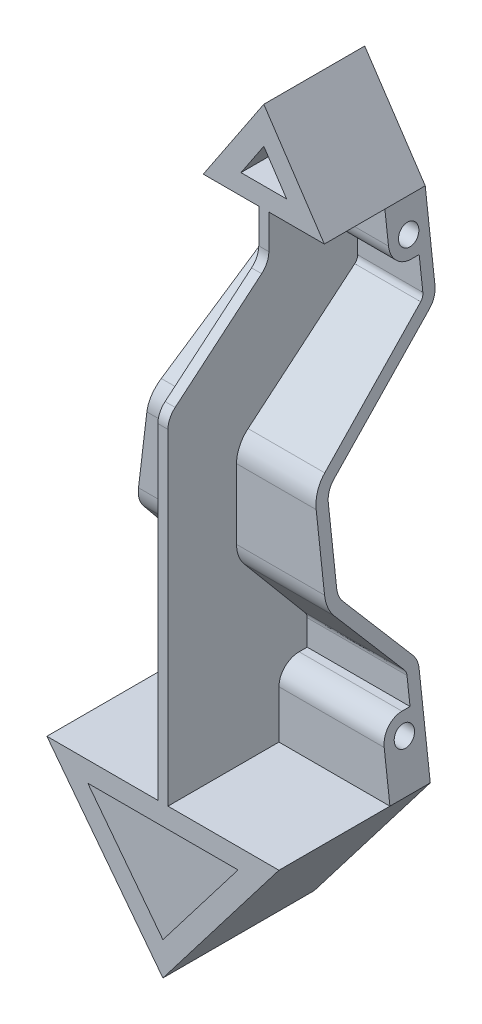
from build123d import *

# Parameters (mm, degrees)
BOSS_EXTRUDE1_DEPTH             = 57.5
CUT_EXTRUDE1_DEPTH              = 334.110342079
CUT_EXTRUDE4_START              = 2.5
CUT_EXTRUDE4_DEPTH              = 322.334448445
BOSS_EXTRUDE2_REACH             = 325.834
SKETCH9_R                       = 5
BOSS_EXTRUDE2_DIRECTION_2_REACH = 325.834
CUT_EXTRUDE5_DEPTH              = 324.834448483
CUT_EXTRUDE5_DEPTH_BACK         = 324.834448483
SKETCH9_3_R                     = 5


with BuildPart() as part:
    # Sketch3 → Boss-Extrude1 (new, symmetric)
    with BuildSketch(Plane.YZ):
        with BuildLine():
            Line((242.818015058, -8.927876097), (206.857769199, 33.927876097))
            ThreePointArc((206.857769199, 33.927876097), (203.423507385, 36.56307787), (199.197324767, 37.5))
            Line((199.197324767, 37.5), (-37.5, 37.5))
            Line((-37.5, 37.5), (-37.5, -37.5))
            Line((-37.5, -37.5), (83.860297657, -37.5))
            ThreePointArc((83.860297657, -37.5), (87.280499091, -36.896926208), (90.288173754, -35.160444431))
            Line((90.288173754, -35.160444431), (126.423201987, -4.839555569))
            ThreePointArc((126.423201987, -4.839555569), (129.43087665, -3.103073792), (132.851078083, -2.5))
            Line((132.851078083, -2.5), (167.490945548, -2.5))
            ThreePointArc((167.490945548, -2.5), (171.717128165, -3.43692213), (175.151389979, -6.072123903))
            Line((175.151389979, -6.072123903), (219.50263215, -58.927876097))
            ThreePointArc((219.50263215, -58.927876097), (222.936893964, -61.56307787), (227.163076582, -62.5))
            Line((227.163076582, -62.5), (312.5, -62.5))
            Line((312.5, -62.5), (312.5, -12.5))
            Line((312.5, -12.5), (250.478459489, -12.5))
            ThreePointArc((250.478459489, -12.5), (246.252276872, -11.56307787), (242.818015058, -8.927876097))
        make_face()
    extrude(amount=BOSS_EXTRUDE1_DEPTH, both=True)

    # Sketch4 → Cut-Extrude1 (cut, through all)
    with BuildSketch(Plane.XY.offset(37.5)):
        Polygon((57.5, 312.5), (0, 312.5), (30, 267.5), (57.5, 37.5), align=None)
        Polygon((-30, 267.5), (0, 312.5), (-57.5, 312.5), (-57.5, 37.5), align=None)
        Polygon((11.314829082, 277.5), (0, 294.472243623), (-11.314829082, 277.5), align=None)
        Polygon((0, -37.5), (-57.5, 37.5), (-57.5, -37.5), align=None)
        Polygon((57.5, -37.5), (57.5, 37.5), (0, -37.5), align=None)
        Polygon((-37.232627886, 27.5), (0, -21.064297242), (37.232627886, 27.5), align=None)
    extrude(amount=-CUT_EXTRUDE1_DEPTH, mode=Mode.SUBTRACT)

    # Sketch7 → Cut-Extrude4 (cut, through all)
    with BuildSketch(Plane.YZ.offset(CUT_EXTRUDE4_START)):
        with BuildLine():
            Line((37.5, 37.5), (37.5, -31.5))
            Line((37.5, -31.5), (83.860297657, -31.5))
            add(Edge.make_bspline(
                [(83.860297657, -31.5), (84.097540548, -31.5), (84.57337446, -31.458390238), (85.263019182, -31.273484118), (85.908338575, -30.972374338), (86.294621244, -30.70182834), (86.474686107, -30.55073598)],
                knots=[-1.570796327, -1.570796327, -1.570796327, -1.570796327, -1.396263402, -1.221730476, -1.047197551, -0.872664626, -0.872664626, -0.872664626, -0.872664626], degree=3))
            Line((86.474686107, -30.55073598), (122.609714339, -0.229847118))
            add(Edge.make_bspline(
                [(122.609714339, -0.229847118), (123.320382845, 0.366474563), (124.848442038, 1.436524541), (127.37869722, 2.615963904), (130.072824203, 3.338033288), (131.926306613, 3.5), (132.851078083, 3.5)],
                knots=[1.570796327, 1.570796327, 1.570796327, 1.570796327, 1.745329252, 1.919862177, 2.094395102, 2.268928028, 2.268928028, 2.268928028, 2.268928028], degree=3))
            Line((132.851078083, 3.5), (167.490945548, 3.5))
            add(Edge.make_bspline(
                [(167.490945548, 3.5), (168.646100732, 3.5), (170.964100646, 3.246604285), (174.273089477, 2.122910497), (177.265048317, 0.308445679), (178.955852245, -1.310444394), (179.701732038, -2.199349317)],
                knots=[0.698131701, 0.698131701, 0.698131701, 0.698131701, 0.916297857, 1.134464014, 1.35263017, 1.570796327, 1.570796327, 1.570796327, 1.570796327], degree=3))
            Line((179.701732038, -2.199349317), (224.052974209, -55.055101511))
            add(Edge.make_bspline(
                [(224.052974209, -55.055101511), (224.24085811, -55.279012825), (224.665398004, -55.685610911), (225.425771497, -56.147439629), (226.271617671, -56.434873066), (226.866794678, -56.5), (227.163076582, -56.5)],
                knots=[-2.443460953, -2.443460953, -2.443460953, -2.443460953, -2.225294796, -2.00712864, -1.788962483, -1.570796327, -1.570796327, -1.570796327, -1.570796327], degree=3))
            Line((227.163076582, -56.5), (267.5, -56.5))
            Line((267.5, -56.5), (267.5, -12.5))
            Line((267.5, -12.5), (250.478459489, -12.5))
            ThreePointArc((250.478459489, -12.5), (246.252276872, -11.56307787), (242.818015058, -8.927876097))
            Line((242.818015058, -8.927876097), (206.857769199, 33.927876097))
            ThreePointArc((206.857769199, 33.927876097), (203.423507385, 36.56307787), (199.197324767, 37.5))
            Line((199.197324767, 37.5), (37.5, 37.5))
        make_face()
    cut_extrude4 = extrude(amount=CUT_EXTRUDE4_DEPTH, mode=Mode.SUBTRACT)

    # Mirror1: Cut-Extrude4 across plane
    add(cut_extrude4.mirror(Plane(origin=(0, 0, 0), x_dir=(0, 0, 1), z_dir=(1, 0, 0))), mode=Mode.SUBTRACT)

    # Boss-Extrude2: up to this plane
    boss_extrude2_end = Plane(origin=(61.110075713, 7.306639487, -62.5), z_dir=(0.9929278168066742, 0.11871963027036327, 0))
    # Sketch9 → Boss-Extrude2 (add, up to the surface)
    with BuildSketch(Plane.YZ, mode=Mode.PRIVATE) as boss_extrude2_sk1:
        with BuildLine():
            Line((61.25, -17.5), (37.5, -17.5))
            Line((37.5, -17.5), (37.5, -37.5))
            Line((37.5, -37.5), (71.25, -37.5))
            Line((71.25, -37.5), (71.25, -27.5))
            ThreePointArc((71.25, -27.5), (68.321067812, -20.428932188), (61.25, -17.5))
        make_face()
        with Locations((61.25, -27.5)):
            Circle(SKETCH9_R, mode=Mode.SUBTRACT)
    boss_extrude2_tool1 = split(extrude(boss_extrude2_sk1.sketch, amount=BOSS_EXTRUDE2_REACH, mode=Mode.PRIVATE), bisect_by=boss_extrude2_end, keep=Keep.BOTH, mode=Mode.PRIVATE)
    add(boss_extrude2_tool1.solids().sort_by_distance((0, 52.889493, -27.789855))[0])
    # Sketch9 → Boss-Extrude2 (add, up to the surface)
    with BuildSketch(Plane.YZ, mode=Mode.PRIVATE) as boss_extrude2_sk2:
        with BuildLine():
            Line((267.5, -62.5), (267.5, -42.5))
            Line((267.5, -42.5), (252.5, -42.5))
            ThreePointArc((252.5, -42.5), (245.428932188, -45.428932188), (242.5, -52.5))
            Line((242.5, -52.5), (242.5, -62.5))
            Line((242.5, -62.5), (267.5, -62.5))
        make_face()
        with Locations((252.5, -52.5)):
            Circle(SKETCH9_R, mode=Mode.SUBTRACT)
    boss_extrude2_tool2 = split(extrude(boss_extrude2_sk2.sketch, amount=BOSS_EXTRUDE2_REACH, mode=Mode.PRIVATE), bisect_by=boss_extrude2_end, keep=Keep.BOTH, mode=Mode.PRIVATE)
    add(boss_extrude2_tool2.solids().sort_by_distance((0, 267.179844, -52.5))[0])

    # Boss-Extrude2 direction 2: up to this plane
    boss_extrude2_direction_2_end = Plane(origin=(-61.110075713, 7.306639487, -62.5), z_dir=(0.9929278168066742, -0.11871963027036327, 0))
    # Sketch9 → Boss-Extrude2 direction 2 (add, up to the surface)
    with BuildSketch(Plane.YZ, mode=Mode.PRIVATE) as boss_extrude2_direction_2_sk1:
        with BuildLine():
            Line((61.25, -17.5), (37.5, -17.5))
            Line((37.5, -17.5), (37.5, -37.5))
            Line((37.5, -37.5), (71.25, -37.5))
            Line((71.25, -37.5), (71.25, -27.5))
            ThreePointArc((71.25, -27.5), (68.321067812, -20.428932188), (61.25, -17.5))
        make_face()
        with Locations((61.25, -27.5)):
            Circle(SKETCH9_R, mode=Mode.SUBTRACT)
    boss_extrude2_direction_2_tool1 = split(extrude(boss_extrude2_direction_2_sk1.sketch, amount=-BOSS_EXTRUDE2_DIRECTION_2_REACH, mode=Mode.PRIVATE), bisect_by=boss_extrude2_direction_2_end, keep=Keep.BOTH, mode=Mode.PRIVATE)
    add(boss_extrude2_direction_2_tool1.solids().sort_by_distance((0, 52.889493, -27.789855))[0])
    # Sketch9 → Boss-Extrude2 direction 2 (add, up to the surface)
    with BuildSketch(Plane.YZ, mode=Mode.PRIVATE) as boss_extrude2_direction_2_sk2:
        with BuildLine():
            Line((267.5, -62.5), (267.5, -42.5))
            Line((267.5, -42.5), (252.5, -42.5))
            ThreePointArc((252.5, -42.5), (245.428932188, -45.428932188), (242.5, -52.5))
            Line((242.5, -52.5), (242.5, -62.5))
            Line((242.5, -62.5), (267.5, -62.5))
        make_face()
        with Locations((252.5, -52.5)):
            Circle(SKETCH9_R, mode=Mode.SUBTRACT)
    boss_extrude2_direction_2_tool2 = split(extrude(boss_extrude2_direction_2_sk2.sketch, amount=-BOSS_EXTRUDE2_DIRECTION_2_REACH, mode=Mode.PRIVATE), bisect_by=boss_extrude2_direction_2_end, keep=Keep.BOTH, mode=Mode.PRIVATE)
    add(boss_extrude2_direction_2_tool2.solids().sort_by_distance((0, 267.179844, -52.5))[0])

    # Sketch9<3> → Cut-Extrude5 (cut, two sides: drawn at the far end of the back side and taken through both)
    with BuildSketch(Plane.YZ.offset(-CUT_EXTRUDE5_DEPTH_BACK)):
        with Locations((61.25, -27.5)):
            Circle(SKETCH9_3_R)
        with Locations((252.5, -52.5)):
            Circle(SKETCH9_3_R)
    extrude(amount=CUT_EXTRUDE5_DEPTH + CUT_EXTRUDE5_DEPTH_BACK, mode=Mode.SUBTRACT)


solid = part.part
